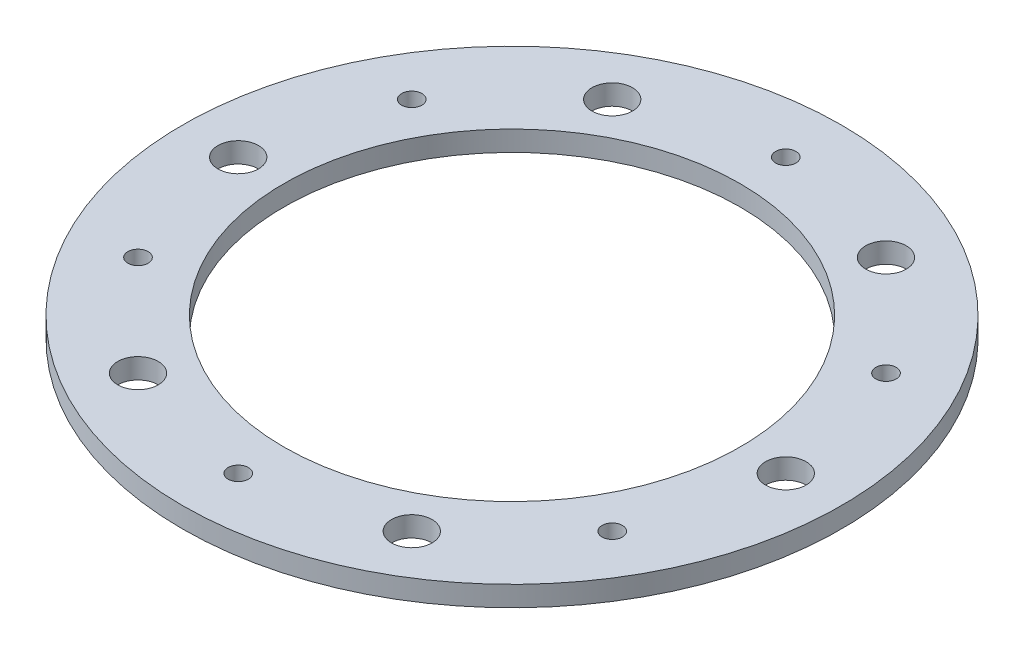
from build123d import *

# Parameters (mm, degrees)
SKETCH1_R           = 32.5
SKETCH1_R_2         = 1
BOSS_EXTRUDE1_DEPTH = 2
SKETCH2_R           = 22.5
SKETCH2_R_2         = 2
CUT_EXTRUDE1_DEPTH  = 47.005434462


with BuildPart() as part:
    # Sketch1 → Boss-Extrude1 (new body)
    with BuildSketch(Plane(origin=(0, 0, 0), x_dir=(1, 0, 0), z_dir=(0, 1, 0))):
        with Locations(Location((0, 0, 0), (0, 0, 270))):
            Circle(SKETCH1_R)
        with Locations(Location((0, 27, 0), (0, 0, 270))):
            Circle(SKETCH1_R_2, mode=Mode.SUBTRACT)
        with Locations(Location((23.382685902, 13.5, 0), (0, 0, 270))):
            Circle(SKETCH1_R_2, mode=Mode.SUBTRACT)
        with Locations(Location((23.382685902, -13.5, 0), (0, 0, 270))):
            Circle(SKETCH1_R_2, mode=Mode.SUBTRACT)
        with Locations(Location((0, -27, 0), (0, 0, 270))):
            Circle(SKETCH1_R_2, mode=Mode.SUBTRACT)
        with Locations(Location((-23.382685902, -13.5, 0), (0, 0, 270))):
            Circle(SKETCH1_R_2, mode=Mode.SUBTRACT)
        with Locations(Location((-23.382685902, 13.5, 0), (0, 0, 270))):
            Circle(SKETCH1_R_2, mode=Mode.SUBTRACT)
    extrude(amount=BOSS_EXTRUDE1_DEPTH)

    # Sketch2 → Cut-Extrude1 (cut, through all)
    with BuildSketch(Plane(origin=(0, 2, 0), x_dir=(1, 0, 0), z_dir=(0, 1, 0))):
        with Locations(Location((0, 0, 0), (0, 0, 270))):
            Circle(SKETCH2_R)
        with Locations(Location((-13.5, 23.382685902, 0), (0, 0, 270))):
            Circle(SKETCH2_R_2)
        with Locations(Location((13.5, 23.382685902, 0), (0, 0, 270))):
            Circle(SKETCH2_R_2)
        with Locations(Location((27, 0, 0), (0, 0, 270))):
            Circle(SKETCH2_R_2)
        with Locations(Location((13.5, -23.382685902, 0), (0, 0, 270))):
            Circle(SKETCH2_R_2)
        with Locations(Location((-13.5, -23.382685902, 0), (0, 0, 270))):
            Circle(SKETCH2_R_2)
        with Locations(Location((-27, 0, 0), (0, 0, 270))):
            Circle(SKETCH2_R_2)
    extrude(amount=-CUT_EXTRUDE1_DEPTH, mode=Mode.SUBTRACT)


solid = part.part
